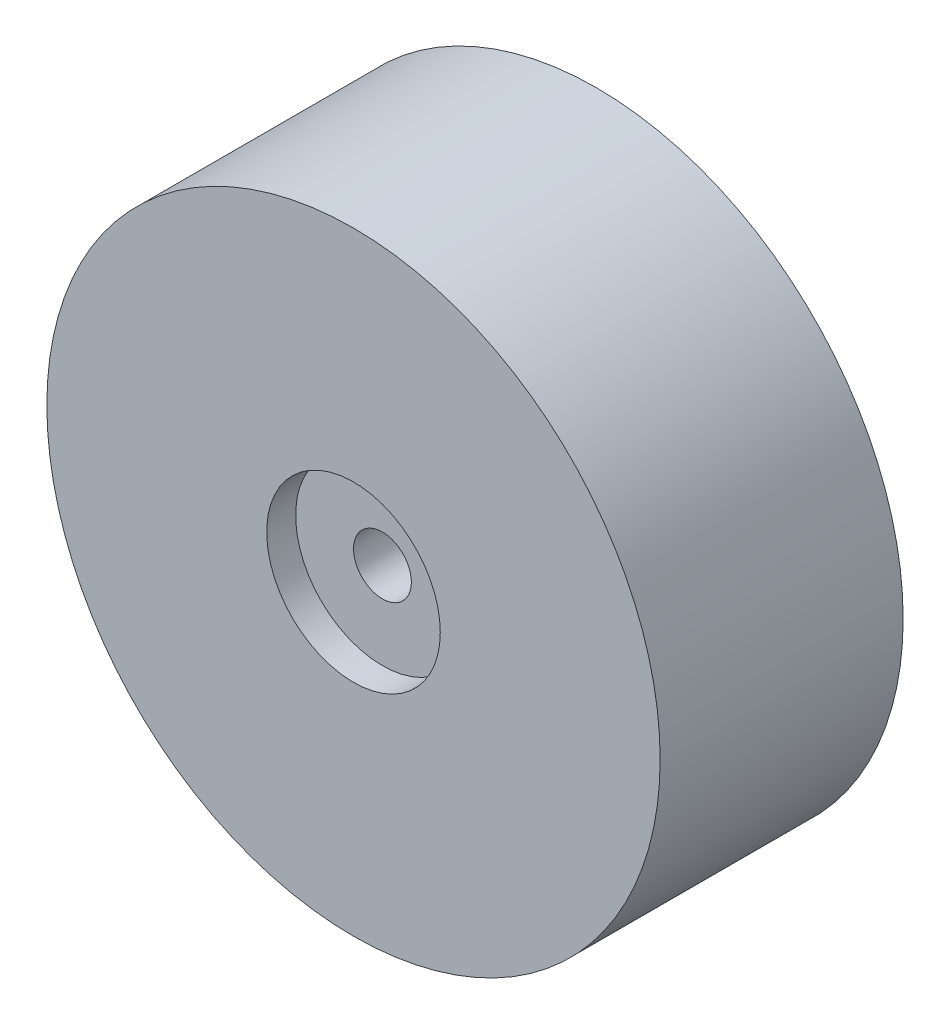
from build123d import *

# Parameters (mm, degrees)
BOSS_EXTRUDE1_DEPTH      = 10.5
BOSS_EXTRUDE1_DEPTH_BACK = 10.5
SKETCH1_R                = 26.5
SKETCH1_R_2              = 7.5
BOSS_EXTRUDE2_DEPTH      = 8
BOSS_EXTRUDE2_DEPTH_BACK = 8
SKETCH3_R                = 7.5
SKETCH3_R_2              = 2.5


with BuildPart() as part:
    # Sketch1 → Boss-Extrude1 (new, two sides: drawn at the far end of the back side and taken through both)
    with BuildSketch(Plane.XY.offset(-BOSS_EXTRUDE1_DEPTH_BACK)):
        Circle(SKETCH1_R)
        Circle(SKETCH1_R_2, mode=Mode.SUBTRACT)
    extrude(amount=BOSS_EXTRUDE1_DEPTH + BOSS_EXTRUDE1_DEPTH_BACK)

    # Sketch3 → Boss-Extrude2 (add, two sides: drawn at the far end of the back side and taken through both)
    with BuildSketch(Plane.XY.offset(-BOSS_EXTRUDE2_DEPTH_BACK)):
        Circle(SKETCH3_R)
        Circle(SKETCH3_R_2, mode=Mode.SUBTRACT)
    extrude(amount=BOSS_EXTRUDE2_DEPTH + BOSS_EXTRUDE2_DEPTH_BACK)


solid = part.part
